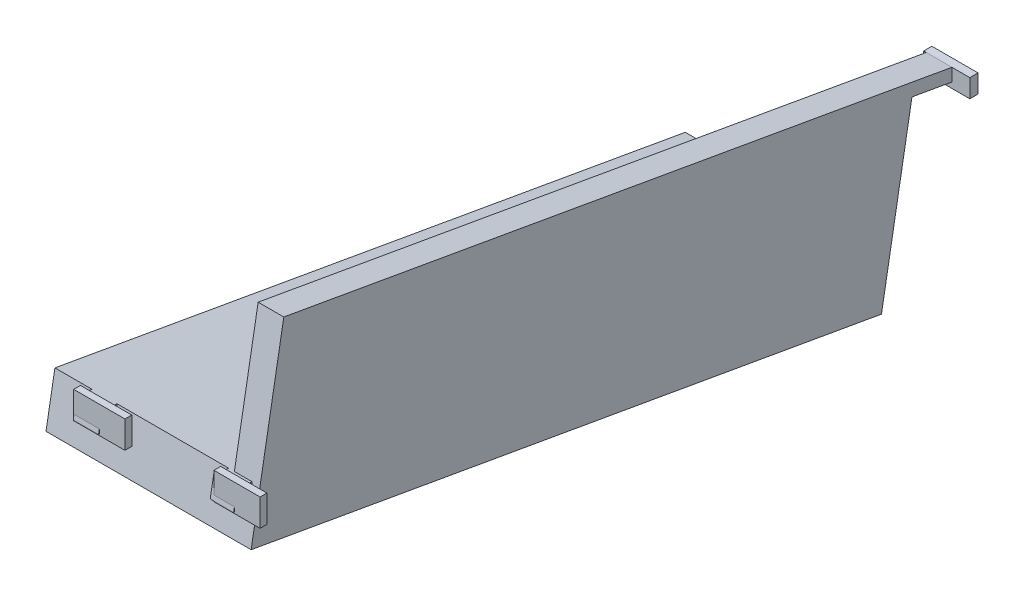
from build123d import *

# Parameters (mm, degrees)
BOSS_EXTRUDE1_DEPTH      = 350
BOSS_EXTRUDE2_DEPTH      = 50
SKETCH3_W                = 50
SKETCH3_H                = 24.508106186
BOSS_EXTRUDE3_DEPTH      = 90
SKETCH4_W                = 49.133865319
SKETCH4_H                = 39.302733228
SKETCH4_W_2              = 45.648473343
BOSS_EXTRUDE4_DEPTH      = 30
BOSS_EXTRUDE5_DEPTH      = 50
BOSS_EXTRUDE5_DEPTH_BACK = 40
SKETCH5_W                = 13.251857059
SKETCH5_H                = 52.991624954
SKETCH5_W_2              = 15.951284084
SKETCH5_H_2              = 35.82978704
BOSS_EXTRUDE6_DEPTH      = 50
BOSS_EXTRUDE6_DEPTH_BACK = 50
SKETCH6_W                = 13.251857059
SKETCH6_H                = 52.991624954


with BuildPart() as part:
    # Sketch1 → Boss-Extrude1 (new body)
    with BuildSketch(Plane(origin=(0, 0, 0), x_dir=(0, 0, -1), z_dir=(1, 0, 0))):
        Polygon((0, 0), (1229.23703731, -216.747655364), (1211.872219543, -315.228430665), (-17.364817767, -98.480775301), align=None)
    extrude(amount=BOSS_EXTRUDE1_DEPTH)

    # Sketch2 → Boss-Extrude2 (add)
    with BuildSketch(Plane(origin=(350, 0, 0), x_dir=(0, 0, -1), z_dir=(1, 0, 0))):
        Polygon((-17.364817767, -98.480775301), (46.338371166, 262.797961946), (1275.575408476, 46.050306583), (1211.872219543, -315.228430665), align=None)
    extrude(amount=BOSS_EXTRUDE2_DEPTH)

    # Sketch3 → Boss-Extrude3 (add)
    with BuildSketch(Plane(origin=(0, -216.747655364, -1229.23703731), x_dir=(-1, 0, 0), z_dir=(0, -0.17364817766693216, -0.9848077530122078))):
        with Locations((-375, 254.597991017)):
            Rectangle(SKETCH3_W, SKETCH3_H)
    extrude(amount=BOSS_EXTRUDE3_DEPTH)

    # Sketch4 → Boss-Extrude4 (add)
    with BuildSketch(Plane(origin=(0, 0, 0), x_dir=(1, 0, 0), z_dir=(0, 0.17364817766693608, 0.9848077530122071))):
        with Locations((96.899550705, -19.651366614)):
            Rectangle(SKETCH4_W, SKETCH4_H)
        with Locations((362.077115008, -19.651366614)):
            Rectangle(SKETCH4_W_2, SKETCH4_H)
    extrude(amount=BOSS_EXTRUDE4_DEPTH)

    # Sketch5 → Boss-Extrude5 (add, two sides: drawn at the far end of the back side and taken through both)
    with BuildSketch(Plane(origin=(384.901351679, 0, 0), x_dir=(0, 0, -1), z_dir=(1, 0, 0)).offset(-BOSS_EXTRUDE5_DEPTH_BACK)):
        with Locations((-28.222892828, -9.605101255)):
            Rectangle(SKETCH5_W, SKETCH5_H)
        with Locations((1357.200809648, 15.148973405)):
            Rectangle(SKETCH5_W_2, SKETCH5_H_2)
    extrude(amount=BOSS_EXTRUDE5_DEPTH + BOSS_EXTRUDE5_DEPTH_BACK)

    # Sketch6 → Boss-Extrude6 (add, two sides: drawn at the far end of the back side and taken through both)
    with BuildSketch(Plane(origin=(121.466483364, 0, 0), x_dir=(0, 0, -1), z_dir=(1, 0, 0)).offset(-BOSS_EXTRUDE6_DEPTH_BACK)):
        with Locations((-28.222892828, -9.605101255)):
            Rectangle(SKETCH6_W, SKETCH6_H)
    extrude(amount=BOSS_EXTRUDE6_DEPTH + BOSS_EXTRUDE6_DEPTH_BACK)


solid = part.part
